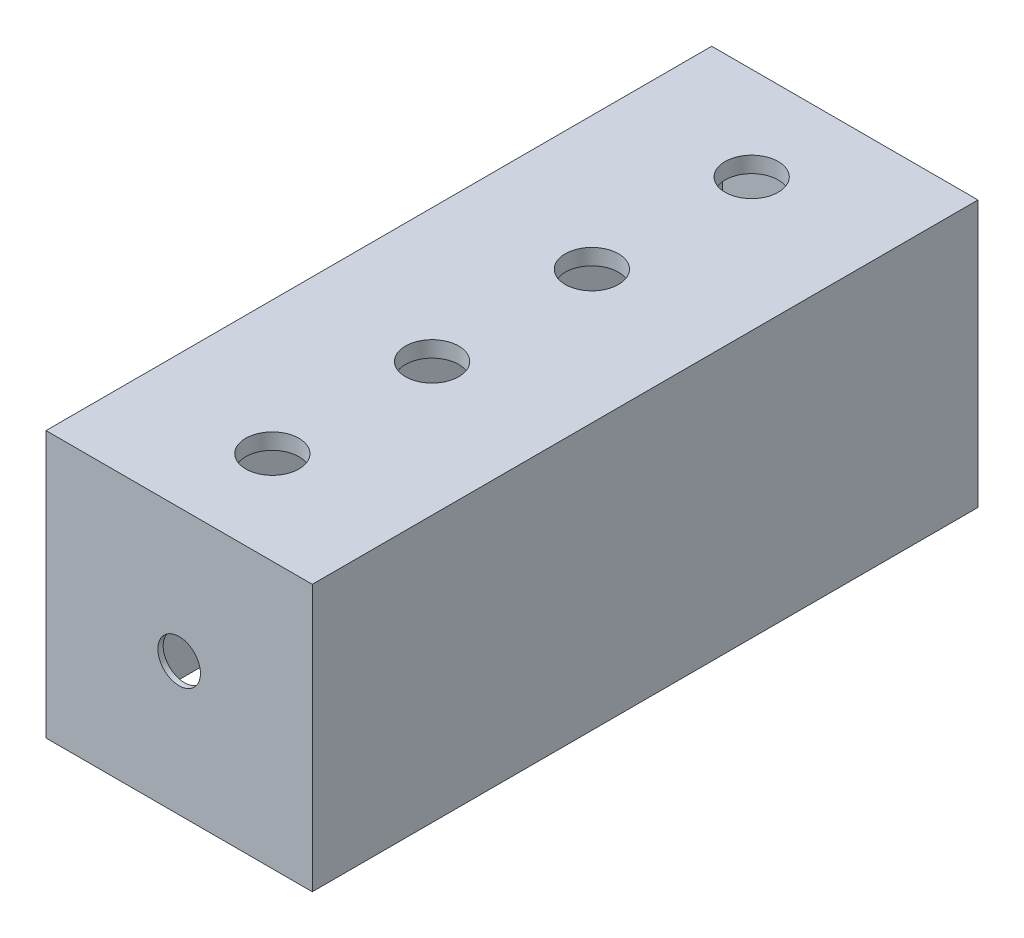
from build123d import *

# Parameters (mm, degrees)
SKETCH1_W           = 50
SKETCH1_H           = 50
BOSS_EXTRUDE1_DEPTH = 125
SKETCH2_R           = 5
CUT_EXTRUDE1_DEPTH  = 145
SKETCH3_R           = 4
CUT_EXTRUDE2_DEPTH  = 145
CUT_EXTRUDE3_START  = -47
SKETCH4_W           = 44
SKETCH4_H           = 123
SKETCH4_R           = 5
CUT_EXTRUDE3_DEPTH  = 47
SKETCH5_R           = 1
CUT_EXTRUDE4_DEPTH  = 5


with BuildPart() as part:
    # Sketch1 → Boss-Extrude1 (new body)
    with BuildSketch(Plane.XY):
        with Locations((-25, 25)):
            Rectangle(SKETCH1_W, SKETCH1_H)
    extrude(amount=BOSS_EXTRUDE1_DEPTH)

    # Sketch2 → Cut-Extrude1 (cut)
    with BuildSketch(Plane(origin=(0, 50, 0), x_dir=(1, 0, 0), z_dir=(0, 1, 0))):
        with Locations(Location((-25, -17.5, 0), (0, 0, 180))):
            Circle(SKETCH2_R)
        with Locations(Location((-25, -47.5, 0), (0, 0, 180))):
            Circle(SKETCH2_R)
        with Locations(Location((-25, -77.5, 0), (0, 0, 180))):
            Circle(SKETCH2_R)
        with Locations(Location((-25, -107.5, 0), (0, 0, 180))):
            Circle(SKETCH2_R)
    extrude(amount=-CUT_EXTRUDE1_DEPTH, mode=Mode.SUBTRACT)

    # Sketch3 → Cut-Extrude2 (cut)
    with BuildSketch(Plane(origin=(0, 0, 0), x_dir=(-1, 0, 0), z_dir=(0, 0, -1))):
        with Locations((25, 25)):
            Circle(SKETCH3_R)
    extrude(amount=-CUT_EXTRUDE2_DEPTH, mode=Mode.SUBTRACT)

    # Sketch4 → Cut-Extrude3 (cut)
    with BuildSketch(Plane(origin=(0, 0, 0), x_dir=(-1, 0, 0), z_dir=(0, -1, 0)).offset(CUT_EXTRUDE3_START)):
        with Locations((25, -62.5)):
            Rectangle(SKETCH4_W, SKETCH4_H)
        with Locations((25, -47.5)):
            Circle(SKETCH4_R, mode=Mode.SUBTRACT)
        with Locations((25, -107.5)):
            Circle(SKETCH4_R, mode=Mode.SUBTRACT)
        with Locations((25, -77.5)):
            Circle(SKETCH4_R, mode=Mode.SUBTRACT)
        with Locations((25, -17.5)):
            Circle(SKETCH4_R, mode=Mode.SUBTRACT)
    extrude(amount=CUT_EXTRUDE3_DEPTH, mode=Mode.SUBTRACT)

    # Sketch5 → Cut-Extrude4 (cut)
    with BuildSketch(Plane(origin=(0, 0, 0), x_dir=(-1, 0, 0), z_dir=(0, -1, 0))):
        with Locations(Location((48.515610021, -122, 0), (0, 0, 90))):
            Circle(SKETCH5_R)
        with Locations(Location((1.594830842, -122, 0), (0, 0, 90))):
            Circle(SKETCH5_R)
        with Locations(Location((48.515610021, -3, 0), (0, 0, 90))):
            Circle(SKETCH5_R)
        with Locations(Location((1.594830842, -3, 0), (0, 0, 90))):
            Circle(SKETCH5_R)
    extrude(amount=-CUT_EXTRUDE4_DEPTH, mode=Mode.SUBTRACT)


solid = part.part
